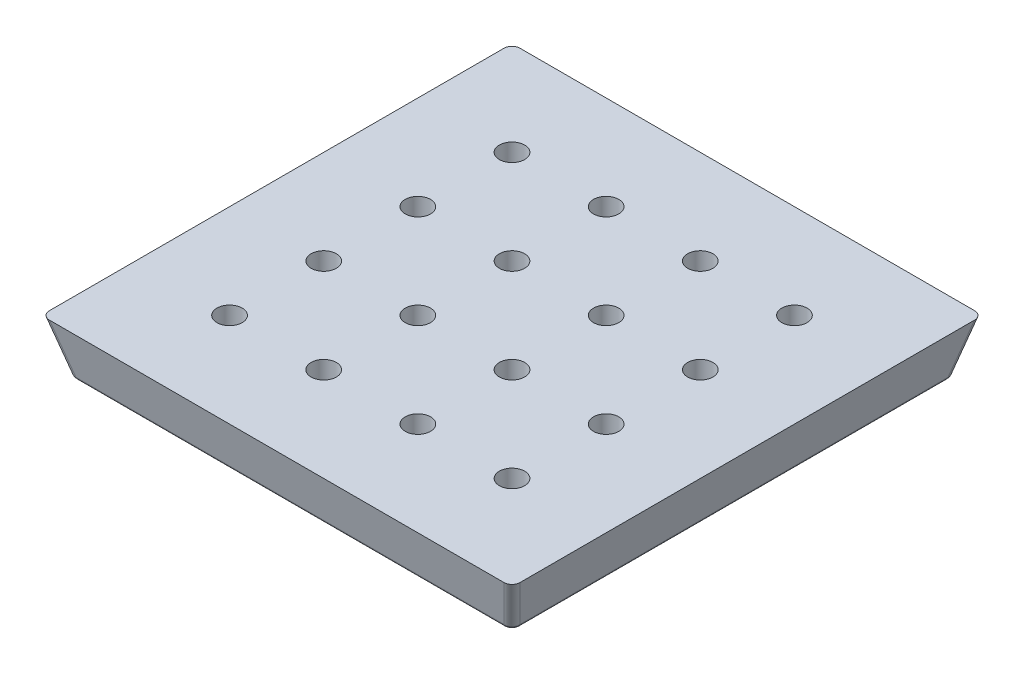
from build123d import *

# Parameters (mm, degrees)
SKETCH1_W           = 266.7
SKETCH1_H           = 266.7
BOSS_EXTRUDE1_DEPTH = 31.75
BOSS_EXTRUDE1_DRAFT = -15
SKETCH3_R           = 3.048
CUT_EXTRUDE1_DEPTH  = 31.75
SKETCH4_R           = 7.62
CUT_EXTRUDE2_DEPTH  = 12.7
FILLET1_R           = 5.08
FILLET2_R           = 2.54


with BuildPart() as part:
    # Sketch1 → Boss-Extrude1 (with draft: the straight prism first)
    with BuildSketch(Plane(origin=(0, 0, 0), x_dir=(1, 0, 0), z_dir=(0, 1, 0))):
        with Locations((133.35, 133.35)):
            Rectangle(SKETCH1_W, SKETCH1_H)
    extrude(amount=BOSS_EXTRUDE1_DEPTH)
    # Boss-Extrude1: the draft: its side faces are tilted about the plane it starts from
    boss_extrude1_sides = [part.faces().sort_by_distance(p)[0] for p in [
        (133.35, 15.875, 0),
        (266.7, 15.875, -133.35),
        (133.35, 15.875, -266.7),
        (0, 15.875, -133.35),
    ]]
    draft(boss_extrude1_sides, Plane(origin=(0, 0, 0), x_dir=(1, 0, 0), z_dir=(0, 1, 0)), BOSS_EXTRUDE1_DRAFT)

    # Sketch3 → Cut-Extrude1 (cut)
    with BuildSketch(Plane(origin=(0, 31.75, 0), x_dir=(1, 0, 0), z_dir=(0, 1, 0))):
        with Locations(Location((48.23621314, 48.23621314, 0), (0, 0, 270))):
            Circle(SKETCH3_R)
        with Locations(Location((104.97981314, 48.23621314, 0), (0, 0, 270))):
            Circle(SKETCH3_R)
        with Locations(Location((161.72341314, 48.23621314, 0), (0, 0, 270))):
            Circle(SKETCH3_R)
        with Locations(Location((218.46701314, 48.23621314, 0), (0, 0, 270))):
            Circle(SKETCH3_R)
        with Locations(Location((104.97981314, 104.97981314, 0), (0, 0, 270))):
            Circle(SKETCH3_R)
        with Locations(Location((161.72341314, 104.97981314, 0), (0, 0, 270))):
            Circle(SKETCH3_R)
        with Locations(Location((218.46701314, 104.97981314, 0), (0, 0, 270))):
            Circle(SKETCH3_R)
        with Locations(Location((104.97981314, 161.72341314, 0), (0, 0, 270))):
            Circle(SKETCH3_R)
        with Locations(Location((161.72341314, 161.72341314, 0), (0, 0, 270))):
            Circle(SKETCH3_R)
        with Locations(Location((218.46701314, 161.72341314, 0), (0, 0, 270))):
            Circle(SKETCH3_R)
        with Locations(Location((104.97981314, 218.46701314, 0), (0, 0, 270))):
            Circle(SKETCH3_R)
        with Locations(Location((161.72341314, 218.46701314, 0), (0, 0, 270))):
            Circle(SKETCH3_R)
        with Locations(Location((218.46701314, 218.46701314, 0), (0, 0, 270))):
            Circle(SKETCH3_R)
        with Locations(Location((48.23621314, 104.97981314, 0), (0, 0, 270))):
            Circle(SKETCH3_R)
        with Locations(Location((48.23621314, 161.72341314, 0), (0, 0, 270))):
            Circle(SKETCH3_R)
        with Locations(Location((48.23621314, 218.46701314, 0), (0, 0, 270))):
            Circle(SKETCH3_R)
    extrude(amount=-CUT_EXTRUDE1_DEPTH, mode=Mode.SUBTRACT)

    # Sketch4 → Cut-Extrude2 (cut)
    with BuildSketch(Plane(origin=(0, 31.75, 0), x_dir=(1, 0, 0), z_dir=(0, 1, 0))):
        with Locations(Location((218.46701314, 48.23621314, 0), (0, 0, 270))):
            Circle(SKETCH4_R)
        with Locations(Location((161.72341314, 48.23621314, 0), (0, 0, 270))):
            Circle(SKETCH4_R)
        with Locations(Location((104.97981314, 48.23621314, 0), (0, 0, 270))):
            Circle(SKETCH4_R)
        with Locations(Location((48.23621314, 48.23621314, 0), (0, 0, 270))):
            Circle(SKETCH4_R)
        with Locations(Location((161.72341314, 104.97981314, 0), (0, 0, 270))):
            Circle(SKETCH4_R)
        with Locations(Location((104.97981314, 104.97981314, 0), (0, 0, 270))):
            Circle(SKETCH4_R)
        with Locations(Location((48.23621314, 104.97981314, 0), (0, 0, 270))):
            Circle(SKETCH4_R)
        with Locations(Location((161.72341314, 161.72341314, 0), (0, 0, 270))):
            Circle(SKETCH4_R)
        with Locations(Location((104.97981314, 161.72341314, 0), (0, 0, 270))):
            Circle(SKETCH4_R)
        with Locations(Location((48.23621314, 161.72341314, 0), (0, 0, 270))):
            Circle(SKETCH4_R)
        with Locations(Location((161.72341314, 218.46701314, 0), (0, 0, 270))):
            Circle(SKETCH4_R)
        with Locations(Location((104.97981314, 218.46701314, 0), (0, 0, 270))):
            Circle(SKETCH4_R)
        with Locations(Location((48.23621314, 218.46701314, 0), (0, 0, 270))):
            Circle(SKETCH4_R)
        with Locations(Location((218.46701314, 104.97981314, 0), (0, 0, 270))):
            Circle(SKETCH4_R)
        with Locations(Location((218.46701314, 161.72341314, 0), (0, 0, 270))):
            Circle(SKETCH4_R)
        with Locations(Location((218.46701314, 218.46701314, 0), (0, 0, 270))):
            Circle(SKETCH4_R)
    extrude(amount=-CUT_EXTRUDE2_DEPTH, mode=Mode.SUBTRACT)

    # Fillet1
    fillet1_edges = [part.edges().sort_by_distance(p)[0] for p in [
        (-4.25369343, 15.875, -270.95369343),
        (270.95369343, 15.875, -270.95369343),
        (270.95369343, 15.875, 4.25369343),
        (-4.25369343, 15.875, 4.25369343),
    ]]
    fillet(fillet1_edges, radius=FILLET1_R)

    # Fillet2
    fillet2_edges = [part.edges().sort_by_distance(p)[0] for p in [
        (0, 0, -133.35),
        (133.35, 0, -266.7),
        (266.7, 0, -133.35),
        (133.35, 0, 0),
        (1.417846965, 0, -1.417846965),
        (265.282153035, 0, -1.417846965),
        (265.282153035, 0, -265.282153035),
        (1.417846965, 0, -265.282153035),
    ]]
    fillet(fillet2_edges, radius=FILLET2_R)


solid = part.part
